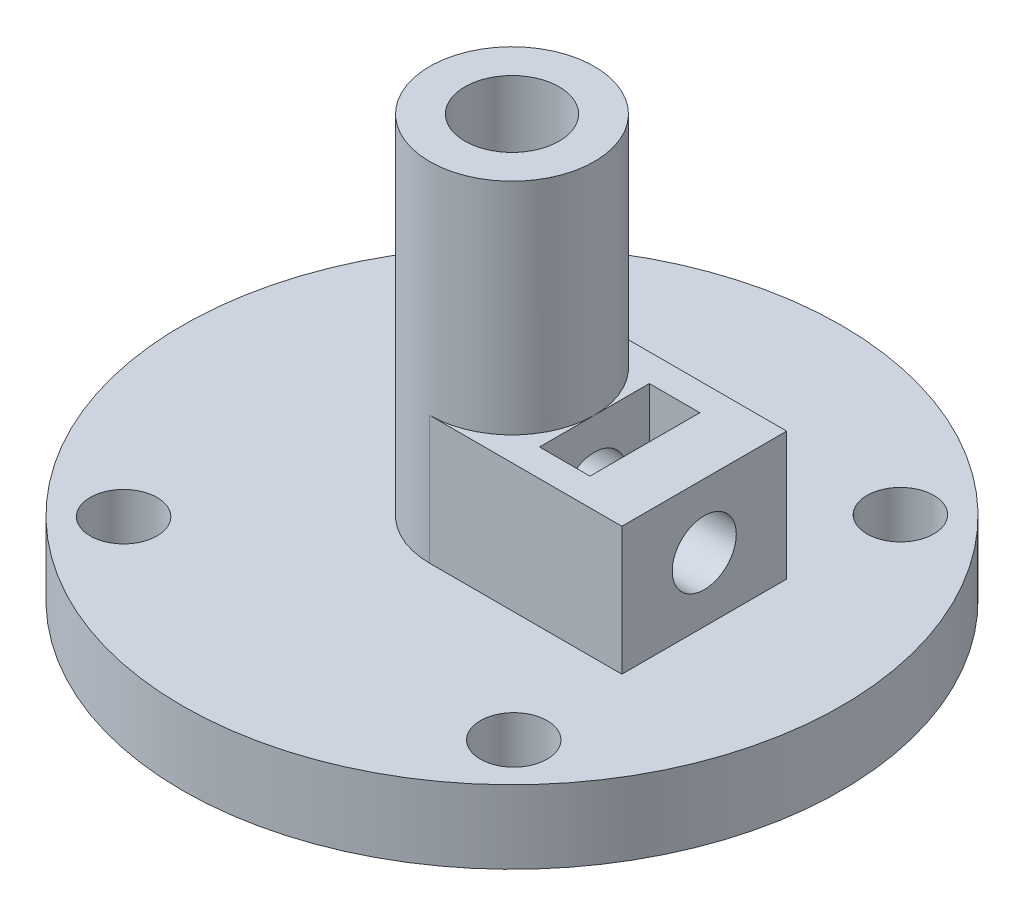
from build123d import *

# Parameters (mm, degrees)
SKETCH1_R           = 18
BOSS_EXTRUDE1_DEPTH = 4
SKETCH2_R           = 1.825
SKETCH2_R_2         = 2.575
CUT_EXTRUDE1_DEPTH  = 26.768197453
BOSS_EXTRUDE2_START = 19
SKETCH3_R           = 2.575
BOSS_EXTRUDE2_DEPTH = 19
BOSS_EXTRUDE4_START = 7
BOSS_EXTRUDE4_DEPTH = 7
BOSS_EXTRUDE5_DEPTH = 7
SKETCH6_R           = 1.75
CUT_EXTRUDE2_DEPTH  = 10


with BuildPart() as part:
    # Sketch1 → Boss-Extrude1 (new body)
    with BuildSketch(Plane(origin=(0, 0, 0), x_dir=(1, 0, 0), z_dir=(0, 1, 0))):
        Circle(SKETCH1_R)
    extrude(amount=BOSS_EXTRUDE1_DEPTH)

    # Sketch2 → Cut-Extrude1 (cut, through all)
    with BuildSketch(Plane(origin=(0, 4, 0), x_dir=(1, 0, 0), z_dir=(0, 1, 0))):
        with Locations((-10.654011001, 10.558979572)):
            Circle(SKETCH2_R)
        with Locations((10.558979572, 10.654011001)):
            Circle(SKETCH2_R)
        with Locations((10.654011001, -10.558979572)):
            Circle(SKETCH2_R)
        Circle(SKETCH2_R_2)
        with Locations((-10.558979572, -10.654011001)):
            Circle(SKETCH2_R)
    extrude(amount=-CUT_EXTRUDE1_DEPTH, mode=Mode.SUBTRACT)

    # Sketch3 → Boss-Extrude2 (add)
    with BuildSketch(Plane(origin=(0, 4, 0), x_dir=(1, 0, 0), z_dir=(0, 1, 0)).offset(BOSS_EXTRUDE2_START)):
        with BuildLine():
            ThreePointArc((0, -4.5), (3.181980515, -3.181980515), (4.5, 0))
            ThreePointArc((4.5, 0), (3.181980515, 3.181980515), (0, 4.5))
            ThreePointArc((0, 4.5), (-4.5, 0), (0, -4.5))
        make_face()
        Circle(SKETCH3_R, mode=Mode.SUBTRACT)
    extrude(amount=-BOSS_EXTRUDE2_DEPTH)

    # Sketch3<4> → Boss-Extrude4 (add)
    with BuildSketch(Plane(origin=(0, 4, 0), x_dir=(1, 0, 0), z_dir=(0, 1, 0)).offset(BOSS_EXTRUDE4_START)):
        with BuildLine():
            ThreePointArc((0, 4.5), (3.181980515, 3.181980515), (4.5, 0))
            Line((4.5, 0), (4.5, 3))
            Line((4.5, 3), (4.5, 4.5))
            Line((4.5, 4.5), (0, 4.5))
        make_face()
        with BuildLine():
            Line((4.5, -3), (4.5, 0))
            ThreePointArc((4.5, 0), (3.181980515, -3.181980515), (0, -4.5))
            Line((0, -4.5), (4.5, -4.5))
            Line((4.5, -4.5), (4.5, -3))
        make_face()
    extrude(amount=-BOSS_EXTRUDE4_DEPTH)

    # Sketch3<5> → Boss-Extrude5 (add)
    with BuildSketch(Plane(origin=(0, 4, 0), x_dir=(1, 0, 0), z_dir=(0, 1, 0))):
        Polygon((4.5, 4.5), (4.5, 3), (7.26, 3), (7.26, -3), (4.5, -3), (4.5, -4.5), (10.5, -4.5), (10.5, 4.5), align=None)
    extrude(amount=BOSS_EXTRUDE5_DEPTH)

    # Sketch6 → Cut-Extrude2 (cut)
    with BuildSketch(Plane(origin=(10.5, 0, 0), x_dir=(0, 0, -1), z_dir=(1, 0, 0))):
        with Locations((0, 7.5)):
            Circle(SKETCH6_R)
    extrude(amount=-CUT_EXTRUDE2_DEPTH, mode=Mode.SUBTRACT)


solid = part.part
